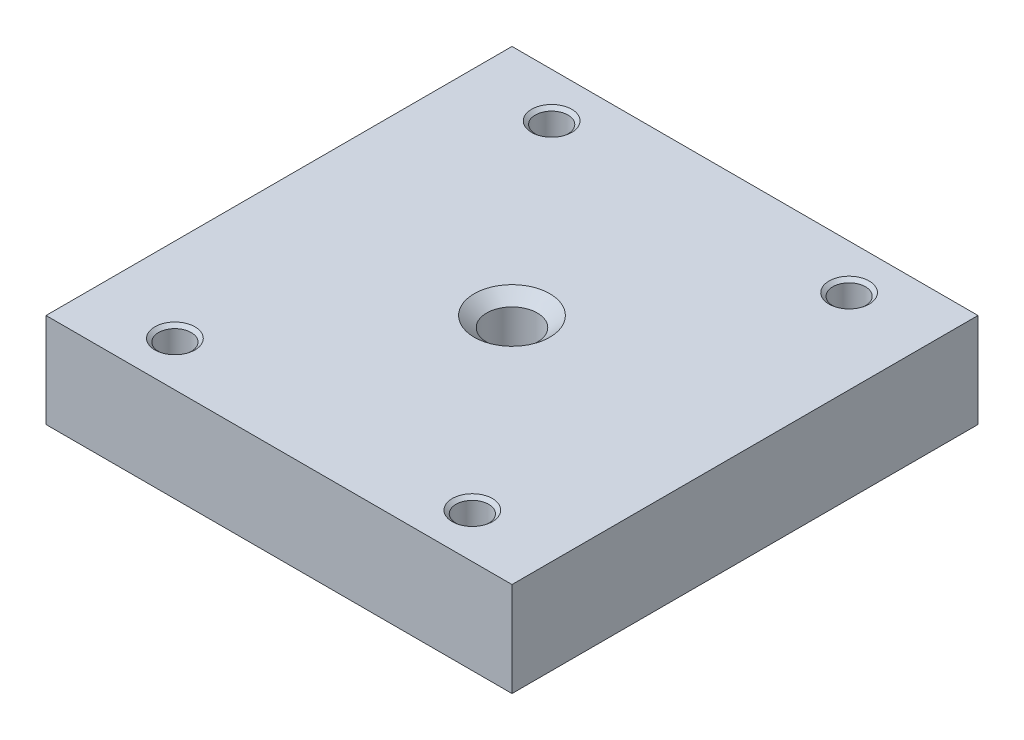
from build123d import *

# Parameters (mm, degrees)
SKETCH1_W                         = 47
SKETCH1_H                         = 47
BOSS_EXTRUDE1_DEPTH               = 9.525
M4X0_7_TAPPED_HOLE1_D             = 3.3
M4X0_7_TAPPED_HOLE1_CSINK_D       = 4.05
M4X0_7_TAPPED_HOLE1_CSINK_ANGLE   = 100
F_1_4_20_TAPPED_HOLE1_D           = 5.1054
F_1_4_20_TAPPED_HOLE1_CSINK_D     = 7.62
F_1_4_20_TAPPED_HOLE1_CSINK_ANGLE = 100


with BuildPart() as part:
    # Sketch1 → Boss-Extrude1 (new body)
    with BuildSketch(Plane(origin=(0, 0, 0), x_dir=(1, 0, 0), z_dir=(0, 1, 0))):
        with Locations((23.5, 23.5)):
            Rectangle(SKETCH1_W, SKETCH1_H)
    extrude(amount=BOSS_EXTRUDE1_DEPTH)

    # M4x0.7 Tapped Hole1 (through all)
    with Locations(Plane(origin=(0, 9.525, 0), x_dir=(1, 0, 0), z_dir=(0, 1, 0))):
        with Locations((38.5, 42.5), (8.5, 42.5), (8.5, 4.5), (38.5, 4.5)):
            CounterSinkHole(M4X0_7_TAPPED_HOLE1_D / 2, M4X0_7_TAPPED_HOLE1_CSINK_D / 2, counter_sink_angle=M4X0_7_TAPPED_HOLE1_CSINK_ANGLE)

    # 1/4-20 Tapped Hole1 (through all)
    with Locations(Plane(origin=(0, 9.525, 0), x_dir=(1, 0, 0), z_dir=(0, 1, 0))):
        with Locations((23.5, 23.5)):
            CounterSinkHole(F_1_4_20_TAPPED_HOLE1_D / 2, F_1_4_20_TAPPED_HOLE1_CSINK_D / 2, counter_sink_angle=F_1_4_20_TAPPED_HOLE1_CSINK_ANGLE)


solid = part.part
